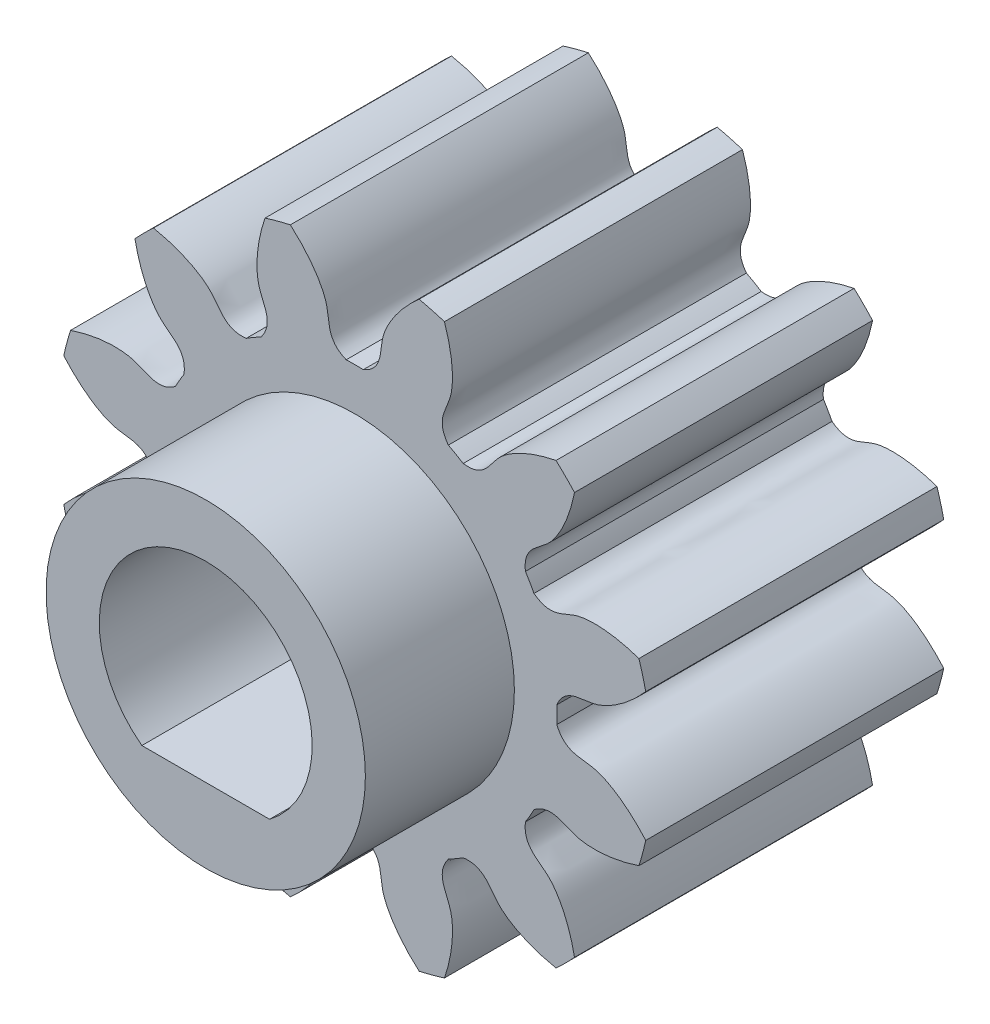
from build123d import *

# Parameters (mm, degrees)
SKETCH_1_R               = 14
EXTRUDE_1_DEPTH          = 14
CUT_EXTRUDE_1_DEPTH      = 25.248711306
PATTERN_CIRCULAR_1_COUNT = 12
SKETCH_4_R               = 7.5
EXTRUDE_2_DEPTH          = 7
CUT_EXTRUDE_2_DEPTH      = 28


with BuildPart() as part:
    # 草图1 → 凸台-拉伸1 (new body)
    with BuildSketch(Plane.XY):
        Circle(SKETCH_1_R)
    extrude(amount=EXTRUDE_1_DEPTH)

    # 草图2 → 切除-拉伸1 (cut, through all)
    with BuildSketch(Plane.XY):
        with BuildLine():
            ThreePointArc((0.401680225, 9.491504254), (0, 9.5), (-0.401680225, 9.491504254))
            add(Edge.make_bspline(
                [(-0.401680225, 9.491504254), (-1.361577738, 9.898614926), (-1.148746958, 10.689637365), (-1.352304376, 11.378961155), (-1.365247708, 11.419811475), (-1.380454501, 11.46466685), (-1.398085738, 11.513452175), (-1.41830525, 11.566086477), (-1.441273032, 11.622484138), (-1.467147122, 11.682554592), (-1.496082862, 11.746202504), (-1.528232954, 11.813327799), (-1.563747275, 11.883825742), (-1.602772771, 11.957587012), (-1.645453327, 12.034497774), (-1.691929648, 12.114439762), (-1.742339142, 12.197290357), (-1.796815797, 12.282922678), (-1.855490069, 12.371205667), (-1.918488769, 12.462004178), (-1.985934952, 12.555179076), (-2.057947808, 12.650587329), (-2.134642556, 12.748082111), (-2.216130341, 12.847512903), (-2.302518131, 12.948725598), (-2.39390862, 13.051562605), (-2.490400133, 13.155862967), (-2.59208653, 13.261462464), (-2.699057115, 13.368193734), (-2.811396554, 13.475886387), (-2.929184784, 13.584367126), (-3.052496933, 13.693459866), (-3.181403243, 13.802985862), (-3.31596899, 13.912763828), (-3.456254416, 14.02261007), (-3.602314655, 14.132338614), (-3.754199671, 14.241761336), (-3.911954189, 14.350688096), (-4.07561764, 14.458926871), (-4.2452241, 14.566283893), (-4.420802241, 14.672563788), (-4.602375278, 14.77756971), (-4.789960922, 14.881103487), (-4.983571339, 14.98296576), (-5.183213107, 15.082956125), (-5.388887185, 15.18087328), (-5.600588875, 15.276515169), (-5.818307792, 15.369679124), (-6.042027853, 15.460162018), (-6.27172721, 15.547760413), (-6.588759411, 15.661455917), (-6.8311872, 15.740202816), (-6.995210805, 15.78994182)],
                knots=[0, 0, 0, 0, 0.218015236, 0.222043642, 0.226545979, 0.231522246, 0.236972443, 0.24289657, 0.249294627, 0.256166614, 0.263512532, 0.271332379, 0.279626157, 0.288393865, 0.297635503, 0.307351072, 0.31754057, 0.328203999, 0.339341357, 0.350952646, 0.363037866, 0.375597015, 0.388630094, 0.402137104, 0.416118043, 0.430572913, 0.445501713, 0.460904444, 0.476781104, 0.493131694, 0.509956215, 0.527254666, 0.545027047, 0.563273358, 0.581993599, 0.601187771, 0.620855872, 0.640997904, 0.661613866, 0.682703758, 0.704267581, 0.726305333, 0.748817015, 0.771802628, 0.795262171, 0.819195644, 0.843603047, 0.868484381, 0.893839644, 0.919668838, 0.945971962, 1, 1, 1, 1], degree=3))
            ThreePointArc((-6.995210805, 15.78994182), (0, 17.270067658), (6.995210805, 15.78994182))
            add(Edge.make_bspline(
                [(0.401680225, 9.491504254), (1.361577738, 9.898614926), (1.148746958, 10.689637365), (1.352304376, 11.378961155), (1.365247708, 11.419811475), (1.380454501, 11.46466685), (1.398085738, 11.513452175), (1.41830525, 11.566086477), (1.441273032, 11.622484138), (1.467147122, 11.682554592), (1.496082862, 11.746202504), (1.528232954, 11.813327799), (1.563747275, 11.883825742), (1.602772771, 11.957587012), (1.645453327, 12.034497774), (1.691929648, 12.114439762), (1.742339142, 12.197290357), (1.796815797, 12.282922678), (1.855490069, 12.371205667), (1.918488769, 12.462004178), (1.985934952, 12.555179076), (2.057947808, 12.650587329), (2.134642556, 12.748082111), (2.216130341, 12.847512903), (2.302518131, 12.948725598), (2.39390862, 13.051562605), (2.490400133, 13.155862967), (2.59208653, 13.261462464), (2.699057115, 13.368193734), (2.811396554, 13.475886387), (2.929184784, 13.584367126), (3.052496933, 13.693459866), (3.181403243, 13.802985862), (3.31596899, 13.912763828), (3.456254416, 14.02261007), (3.602314655, 14.132338614), (3.754199671, 14.241761336), (3.911954189, 14.350688096), (4.07561764, 14.458926871), (4.2452241, 14.566283893), (4.420802241, 14.672563788), (4.602375278, 14.77756971), (4.789960922, 14.881103487), (4.983571339, 14.98296576), (5.183213107, 15.082956125), (5.388887185, 15.18087328), (5.600588875, 15.276515169), (5.818307792, 15.369679124), (6.042027853, 15.460162018), (6.27172721, 15.547760413), (6.588759411, 15.661455917), (6.8311872, 15.740202816), (6.995210805, 15.78994182)],
                knots=[0, 0, 0, 0, 0.218015236, 0.222043642, 0.226545979, 0.231522246, 0.236972443, 0.24289657, 0.249294627, 0.256166614, 0.263512532, 0.271332379, 0.279626157, 0.288393865, 0.297635503, 0.307351072, 0.31754057, 0.328203999, 0.339341357, 0.350952646, 0.363037866, 0.375597015, 0.388630094, 0.402137104, 0.416118043, 0.430572913, 0.445501713, 0.460904444, 0.476781104, 0.493131694, 0.509956215, 0.527254666, 0.545027047, 0.563273358, 0.581993599, 0.601187771, 0.620855872, 0.640997904, 0.661613866, 0.682703758, 0.704267581, 0.726305333, 0.748817015, 0.771802628, 0.795262171, 0.819195644, 0.843603047, 0.868484381, 0.893839644, 0.919668838, 0.945971962, 1, 1, 1, 1], degree=3))
        make_face()
    cut_extrude_1 = extrude(amount=CUT_EXTRUDE_1_DEPTH, mode=Mode.SUBTRACT)

    # 阵列(圆周)1: 切除-拉伸1 ×12 about axis
    pattern_circular_1_axis = Axis((0, 0, 14), (0, 0, -1))
    for i in range(1, PATTERN_CIRCULAR_1_COUNT):
        add(cut_extrude_1.rotate(pattern_circular_1_axis, i * 360 / PATTERN_CIRCULAR_1_COUNT), mode=Mode.SUBTRACT)

    # 草图4 → 凸台-拉伸2 (add)
    with BuildSketch(Plane.XY.offset(14)):
        Circle(SKETCH_4_R)
    extrude(amount=EXTRUDE_2_DEPTH)

    # 草图5 → 切除-拉伸2 (cut)
    with BuildSketch(Plane.XY.offset(21)):
        with BuildLine():
            Line((3, -4), (-3, -4))
            ThreePointArc((-3, -4), (0, 5), (3, -4))
        make_face()
    extrude(amount=-CUT_EXTRUDE_2_DEPTH, mode=Mode.SUBTRACT)


solid = part.part
